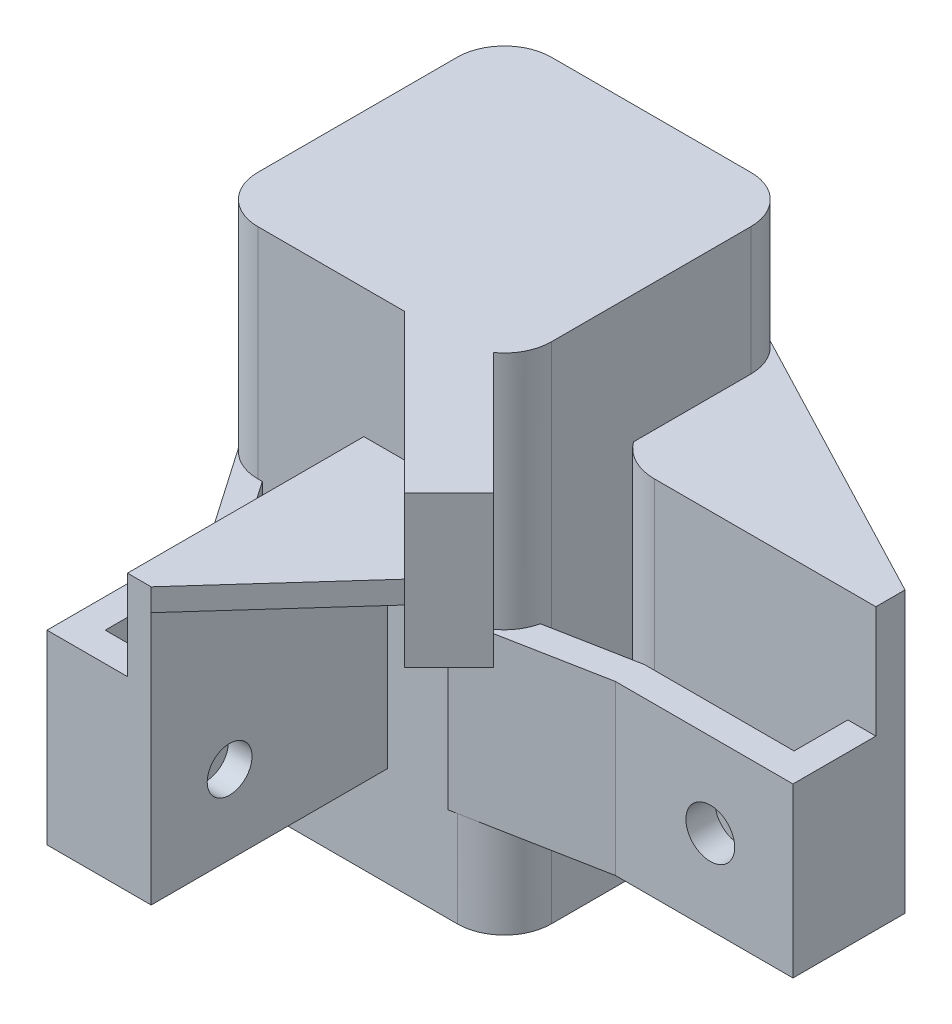
from build123d import *

# Parameters (mm, degrees)
BOSS_EXTRUDE1_DEPTH     = 2.54
BOSS_EXTRUDE2_START     = 54.61
SKETCH2_W               = 28.194
SKETCH2_H               = 28.194
BOSS_EXTRUDE2_DEPTH     = 54.61
SKETCH4_R               = 5.08
CUT_EXTRUDE2_DEPTH      = 1.524
SKETCH5_R               = 2.54
CUT_EXTRUDE3_DEPTH      = 1.016
BOSS_EXTRUDE3_DEPTH     = 17.145
CUT_EXTRUDE4_START      = -7.10691
SKETCH7_R               = 2.794
CUT_EXTRUDE4_DEPTH      = 7.10691
BOSS_EXTRUDE4_DEPTH     = 2.54
BOSS_EXTRUDE5_DEPTH     = 10.16
BOSS_EXTRUDE6_DEPTH     = 19.05
CUT_EXTRUDE5_DEPTH      = 13.716
CUT_EXTRUDE5_DEPTH_BACK = 20.32
SKETCH13_R              = 2.76606
BOSS_EXTRUDE12_DEPTH    = 2.54
SKETCH15_W              = 2.689899245
SKETCH15_H              = 26.801981191
BOSS_EXTRUDE13_DEPTH    = 7.62
BOSS_EXTRUDE14_DEPTH    = 21.082
SKETCH17_R              = 2.54
CUT_EXTRUDE7_DEPTH      = 21.082
CUT_EXTRUDE8_DEPTH      = 21.082


with BuildPart() as part:
    # Sketch1 → Boss-Extrude1 (new body)
    with BuildSketch(Plane(origin=(0, 0, 0), x_dir=(1, 0, 0), z_dir=(0, 1, 0))):
        with BuildLine():
            Line((-11.303, -16.637), (11.303, -16.637))
            ThreePointArc((11.303, -16.637), (15.074707571, -15.074707571), (16.637, -11.303))
            Line((16.637, -11.303), (16.637, 11.303))
            ThreePointArc((16.637, 11.303), (15.074707571, 15.074707571), (11.303, 16.637))
            Line((11.303, 16.637), (-11.303, 16.637))
            ThreePointArc((-11.303, 16.637), (-15.074707571, 15.074707571), (-16.637, 11.303))
            Line((-16.637, 11.303), (-16.637, -11.303))
            ThreePointArc((-16.637, -11.303), (-15.074707571, -15.074707571), (-11.303, -16.637))
        make_face()
    extrude(amount=BOSS_EXTRUDE1_DEPTH)

    # Sketch2 → Boss-Extrude2 (add)
    with BuildSketch(Plane.XZ.offset(BOSS_EXTRUDE2_START)):
        with BuildLine():
            Line((-11.303, 16.637), (11.303, 16.637))
            ThreePointArc((11.303, 16.637), (15.074707571, 15.074707571), (16.637, 11.303))
            Line((16.637, 11.303), (16.637, -11.303))
            ThreePointArc((16.637, -11.303), (15.074707571, -15.074707571), (11.303, -16.637))
            Line((11.303, -16.637), (-11.303, -16.637))
            ThreePointArc((-11.303, -16.637), (-15.074707571, -15.074707571), (-16.637, -11.303))
            Line((-16.637, -11.303), (-16.637, 11.303))
            ThreePointArc((-16.637, 11.303), (-15.074707571, 15.074707571), (-11.303, 16.637))
        make_face()
        Rectangle(SKETCH2_W, SKETCH2_H, mode=Mode.SUBTRACT)
    extrude(amount=-BOSS_EXTRUDE2_DEPTH)

    # Sketch4 → Cut-Extrude2 (cut)
    with BuildSketch(Plane(origin=(0, 0, -16.637), x_dir=(-1, 0, 0), z_dir=(0, 0, -1))):
        with Locations((0, -24.13)):
            Circle(SKETCH4_R)
    extrude(amount=-CUT_EXTRUDE2_DEPTH, mode=Mode.SUBTRACT)

    # Sketch5 → Cut-Extrude3 (cut)
    with BuildSketch(Plane(origin=(0, 0, -15.113), x_dir=(-1, 0, 0), z_dir=(0, 0, -1))):
        with Locations((0, -24.13)):
            Circle(SKETCH5_R)
    extrude(amount=-CUT_EXTRUDE3_DEPTH, mode=Mode.SUBTRACT)

    # Sketch6 → Boss-Extrude3 (add)
    with BuildSketch(Plane(origin=(0, 2.54, 0), x_dir=(1, 0, 0), z_dir=(0, 1, 0))):
        Polygon((5.334, -16.637), (23.168788656, -34.471788656), (28.194132537, -29.446444776), (14.396212982, -15.648525221), align=None)
    extrude(amount=-BOSS_EXTRUDE3_DEPTH)

    # Sketch7 → Cut-Extrude4 (cut)
    with BuildSketch(Plane(origin=(-0.62615612, 0, 0.62615612), x_dir=(-0.7071067811865477, 0, -0.7071067811865475), z_dir=(0.7071067811865475, 0, -0.7071067811865477)).offset(CUT_EXTRUDE4_START)):
        with Locations((-32.249043089, -6.0325)):
            Circle(SKETCH7_R)
    extrude(amount=CUT_EXTRUDE4_DEPTH, mode=Mode.SUBTRACT)

    # Sketch9 → Boss-Extrude4 (add)
    with BuildSketch(Plane(origin=(0, -11.938, 0), x_dir=(1, 0, 0), z_dir=(0, 1, 0))):
        with BuildLine():
            Line((46.562129264, -1.143), (13.310139602, 16.273079187))
            Line((13.310139602, 16.273079187), (12.964036607, 15.721651043))
            Line((12.964036607, 15.721651043), (15.475295461, 12.118791083))
            Line((15.475295461, 12.118791083), (15.475295461, 3.129239018))
            Line((15.475295461, 3.129239018), (15.475295461, 1.47632638))
            ThreePointArc((15.475295461, 1.47632638), (17.263507322, -2.715683033), (21.480153786, -4.445))
            Line((21.480153786, -4.445), (38.24328617, -4.445))
            Line((38.24328617, -4.445), (46.562129264, -4.445))
            Line((46.562129264, -4.445), (46.562129264, -1.143))
        make_face()
    extrude(amount=-BOSS_EXTRUDE4_DEPTH)

    # Sketch10 → Boss-Extrude5 (add)
    with BuildSketch(Plane.XZ.offset(14.478)):
        with BuildLine():
            Line((46.562129264, 1.143), (46.562129264, 4.445))
            Line((46.562129264, 4.445), (21.480153786, 4.445))
            ThreePointArc((21.480153786, 4.445), (18.765347806, 3.796345215), (16.637, 1.990504648))
            Line((16.637, 1.990504648), (16.637, -2.114151714))
            ThreePointArc((16.637, -2.114151714), (18.849336789, 0.264449502), (21.976688198, 1.143))
            Line((21.976688198, 1.143), (46.562129264, 1.143))
        make_face()
    extrude(amount=BOSS_EXTRUDE5_DEPTH)

    # Sketch11 → Boss-Extrude6 (add)
    with BuildSketch(Plane.XZ.offset(24.638)):
        with BuildLine():
            Line((21.976688198, 1.143), (46.562129264, 1.143))
            Line((46.562129264, 1.143), (46.562129264, 4.445))
            Line((46.562129264, 4.445), (46.562129264, 13.843))
            Line((46.562129264, 13.843), (26.43228617, 13.843))
            Line((26.43228617, 13.843), (10.498277863, 16.887218473))
            Line((10.498277863, 16.887218473), (10.837249294, 13.520457424))
            Line((10.837249294, 13.520457424), (26.43228617, 10.541))
            Line((26.43228617, 10.541), (43.387129264, 10.541))
            Line((43.387129264, 10.541), (43.387129264, 4.445))
            Line((43.387129264, 4.445), (21.480153786, 4.445))
            ThreePointArc((21.480153786, 4.445), (18.765347806, 3.796345215), (16.637, 1.990504648))
            Line((16.637, 1.990504648), (16.637, -2.114151714))
            ThreePointArc((16.637, -2.114151714), (18.849336789, 0.264449502), (21.976688198, 1.143))
        make_face()
    extrude(amount=BOSS_EXTRUDE6_DEPTH)

    # Sketch13 → Cut-Extrude5 (cut, two sides: drawn at the far end of the back side and taken through both)
    with BuildSketch(Plane.XY.offset(13.843).offset(-CUT_EXTRUDE5_DEPTH_BACK)):
        with Locations(Location((37.189529264, -34.163, 0), (0, 0, 180))):
            Circle(SKETCH13_R)
    extrude(amount=CUT_EXTRUDE5_DEPTH + CUT_EXTRUDE5_DEPTH_BACK, mode=Mode.SUBTRACT)

    # Sketch14 → Boss-Extrude12 (add)
    with BuildSketch(Plane.XZ.offset(14.605)):
        Polygon((3.404930005, 43.438981191), (0.71503076, 43.438981191), (0.71503076, 16.637), (5.334, 16.637), (11.303, 16.637), (21.779567071, 23.03187931), align=None)
    extrude(amount=-BOSS_EXTRUDE12_DEPTH)

    # Sketch15 → Boss-Extrude13 (add)
    with BuildSketch(Plane.XZ.offset(14.605)):
        with Locations((2.059980383, 30.037990596)):
            Rectangle(SKETCH15_W, SKETCH15_H)
    extrude(amount=BOSS_EXTRUDE13_DEPTH)

    # Sketch16 → Boss-Extrude14 (add)
    with BuildSketch(Plane.XZ.offset(22.225)):
        Polygon((3.404930005, 16.637), (3.404930005, 43.438981191), (-8.406765612, 43.438981191), (-8.406765612, 24.889361191), (-15.692885389, 14.332927767), (-12.390885389, 14.332927767), (-5.104765612, 24.889361191), (-5.104765612, 40.136981191), (0.71503076, 40.136981191), (0.71503076, 16.637), align=None)
    extrude(amount=BOSS_EXTRUDE14_DEPTH)

    # Sketch17 → Cut-Extrude7 (cut)
    with BuildSketch(Plane.ZY.offset(8.406765612)):
        with Locations((34.548981191, -34.417)):
            Circle(SKETCH17_R)
    extrude(amount=-CUT_EXTRUDE7_DEPTH, mode=Mode.SUBTRACT)

    # Sketch18 → Cut-Extrude8 (cut)
    with BuildSketch(Plane.XZ.offset(43.688)):
        Polygon((14.097, 12.897676695), (10.837249294, 13.520457424), (10.779201972, 14.097), (14.097, 14.097), align=None)
    extrude(amount=-CUT_EXTRUDE8_DEPTH, mode=Mode.SUBTRACT)


solid = part.part
